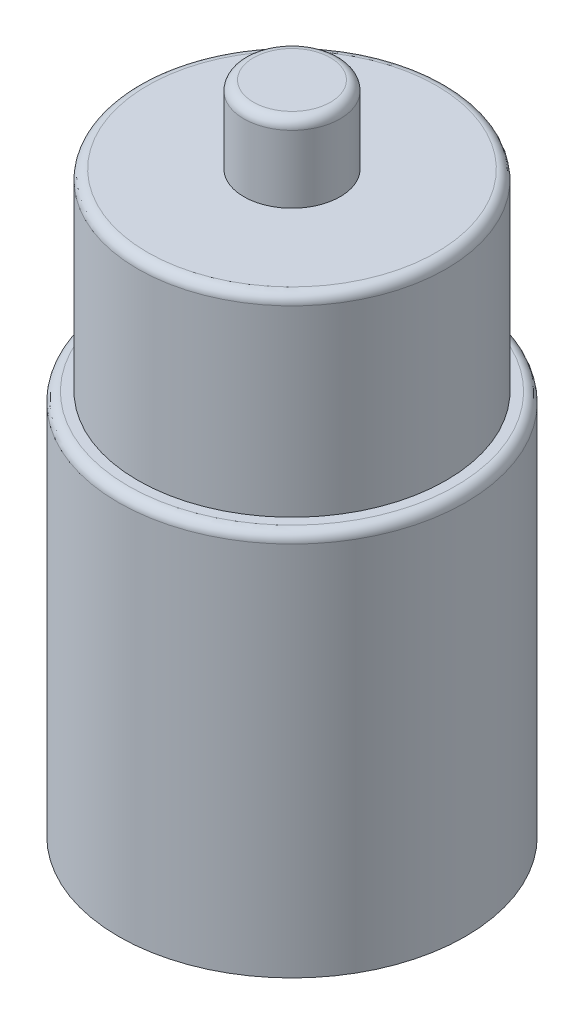
from build123d import *

# Parameters (mm, degrees)
SKETCH1_R           = 9
BOSS_EXTRUDE1_DEPTH = 20
SKETCH2_R           = 8
BOSS_EXTRUDE2_DEPTH = 10
SKETCH3_R           = 2.5
BOSS_EXTRUDE3_DEPTH = 4
FILLET1_R           = 0.5


with BuildPart() as part:
    # Sketch1 → Boss-Extrude1 (new body)
    with BuildSketch(Plane(origin=(0, 0, 0), x_dir=(1, 0, 0), z_dir=(0, 1, 0))):
        with Locations(Location((0, 0, 0), (0, 0, 270))):
            Circle(SKETCH1_R)
    extrude(amount=BOSS_EXTRUDE1_DEPTH)

    # Sketch2 → Boss-Extrude2 (add)
    with BuildSketch(Plane(origin=(0, 20, 0), x_dir=(1, 0, 0), z_dir=(0, 1, 0))):
        with Locations(Location((0, 0, 0), (0, 0, 270))):
            Circle(SKETCH2_R)
    extrude(amount=BOSS_EXTRUDE2_DEPTH)

    # Sketch3 → Boss-Extrude3 (add)
    with BuildSketch(Plane(origin=(0, 30, 0), x_dir=(1, 0, 0), z_dir=(0, 1, 0))):
        with Locations(Location((0, 0, 0), (0, 0, 270))):
            Circle(SKETCH3_R)
    extrude(amount=BOSS_EXTRUDE3_DEPTH)

    # Fillet1
    fillet1_edges = [part.edges().sort_by_distance(p)[0] for p in [
        (0, 34, -2.5),
        (0, 20, -9),
        (0, 30, -8),
    ]]
    fillet(fillet1_edges, radius=FILLET1_R)


solid = part.part
